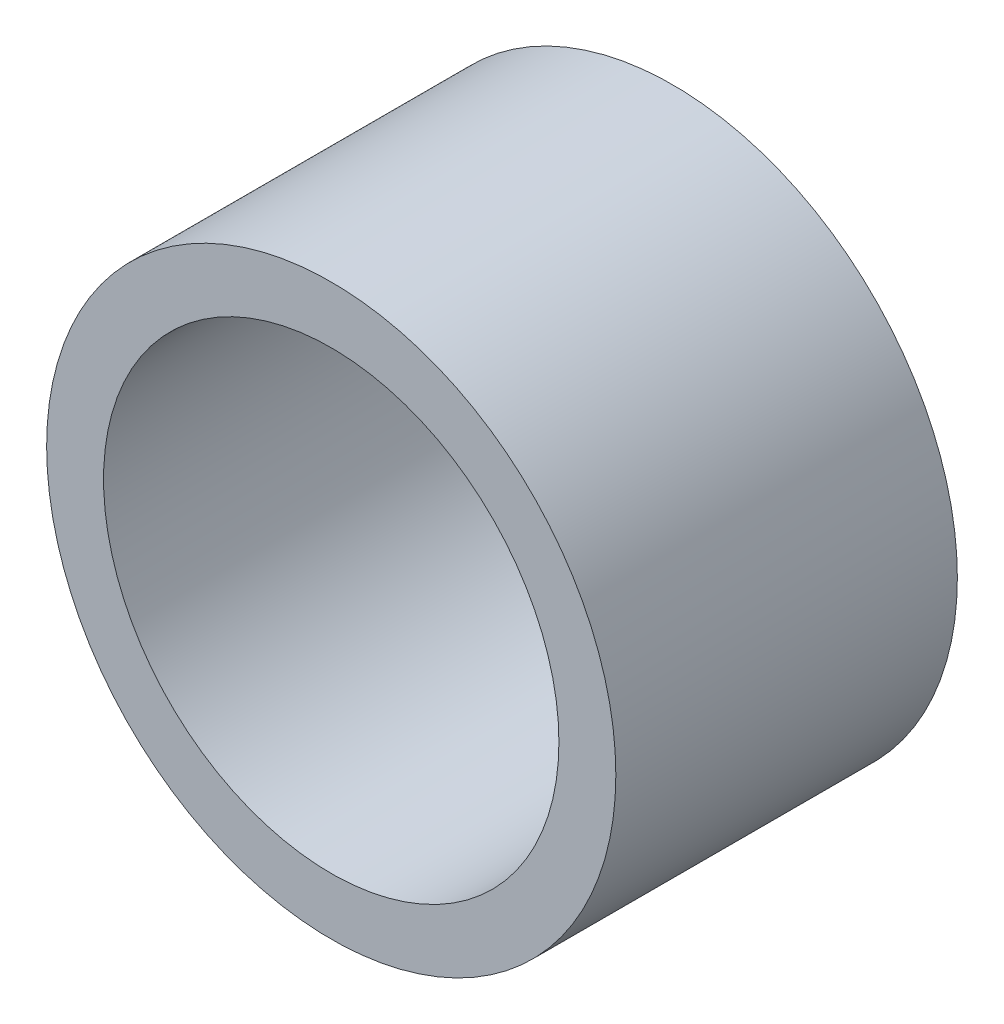
from build123d import *

# Parameters (mm, degrees)
SKETCH1_R           = 10
SKETCH1_R_2         = 8
BOSS_EXTRUDE1_DEPTH = 12


with BuildPart() as part:
    # Sketch1 → Boss-Extrude1 (new body)
    with BuildSketch(Plane.XY):
        Circle(SKETCH1_R)
        Circle(SKETCH1_R_2, mode=Mode.SUBTRACT)
    extrude(amount=BOSS_EXTRUDE1_DEPTH)


solid = part.part
